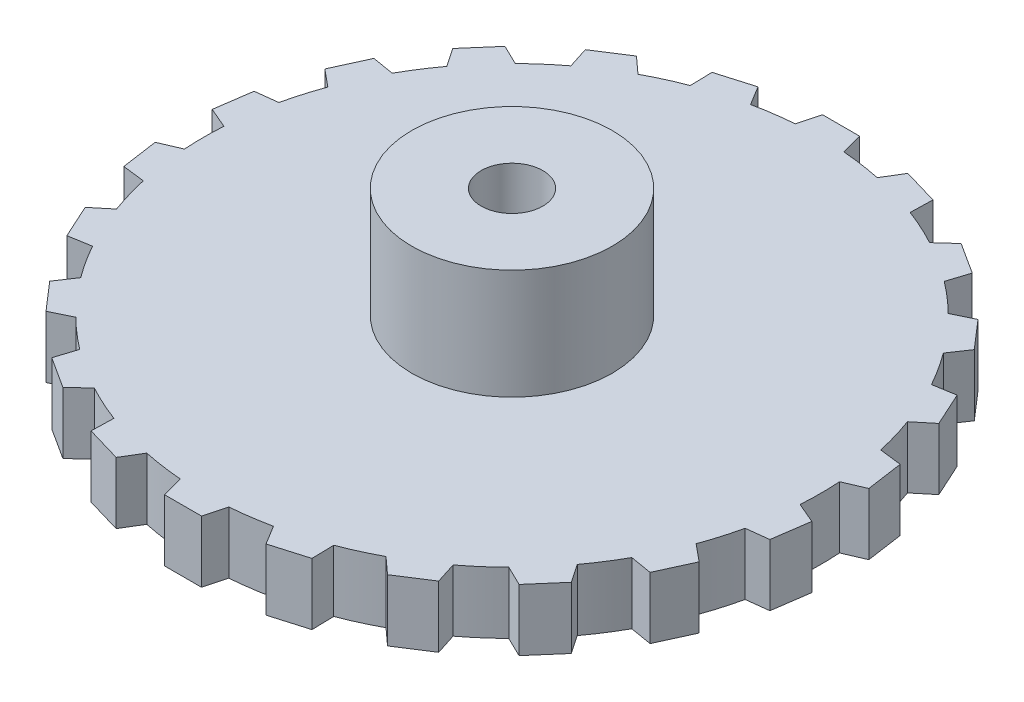
from build123d import *

# Parameters (mm, degrees)
SKETCH1_R           = 30
BOSS_EXTRUDE3_DEPTH = 6
BOSS_EXTRUDE2_DEPTH = 6
CIRPATTERN3_COUNT   = 22
SKETCH5_R           = 9.75
BOSS_EXTRUDE4_DEPTH = 10.7
SKETCH6_R           = 3
CUT_EXTRUDE1_DEPTH  = 49.191740155


with BuildPart() as part:
    # Sketch1 → Boss-Extrude3 (new body)
    with BuildSketch(Plane(origin=(0, 0, 0), x_dir=(1, 0, 0), z_dir=(0, 1, 0))):
        with Locations(Location((0, 0, 0), (0, 0, 270))):
            Circle(SKETCH1_R)
    extrude(amount=BOSS_EXTRUDE3_DEPTH)

    # Sketch2 → Boss-Extrude2 (add)
    with BuildSketch(Plane(origin=(0, 6, 0), x_dir=(1, 0, 0), z_dir=(0, 1, 0))):
        Polygon((0, 32), (1.8, 32), (3.407695155, 26), (0, 26), (-3.407695155, 26), (-1.8, 32), align=None)
    boss_extrude2 = extrude(amount=-BOSS_EXTRUDE2_DEPTH)

    # CirPattern3: Boss-Extrude2 ×22 about axis
    cirpattern3_axis = Axis((0, 0, 0), (0, 1, 0))
    for i in range(1, CIRPATTERN3_COUNT):
        add(boss_extrude2.rotate(cirpattern3_axis, i * 360 / CIRPATTERN3_COUNT))

    # Sketch5 → Boss-Extrude4 (add)
    with BuildSketch(Plane(origin=(0, 6, 0), x_dir=(1, 0, 0), z_dir=(0, 1, 0))):
        with Locations(Location((0, 0, 0), (0, 0, 270))):
            Circle(SKETCH5_R)
    extrude(amount=BOSS_EXTRUDE4_DEPTH)

    # Sketch6 → Cut-Extrude1 (cut, through all)
    with BuildSketch(Plane(origin=(0, 16.7, 0), x_dir=(1, 0, 0), z_dir=(0, 1, 0))):
        with Locations(Location((0, 0, 0), (0, 0, 270))):
            Circle(SKETCH6_R)
    extrude(amount=-CUT_EXTRUDE1_DEPTH, mode=Mode.SUBTRACT)


solid = part.part
